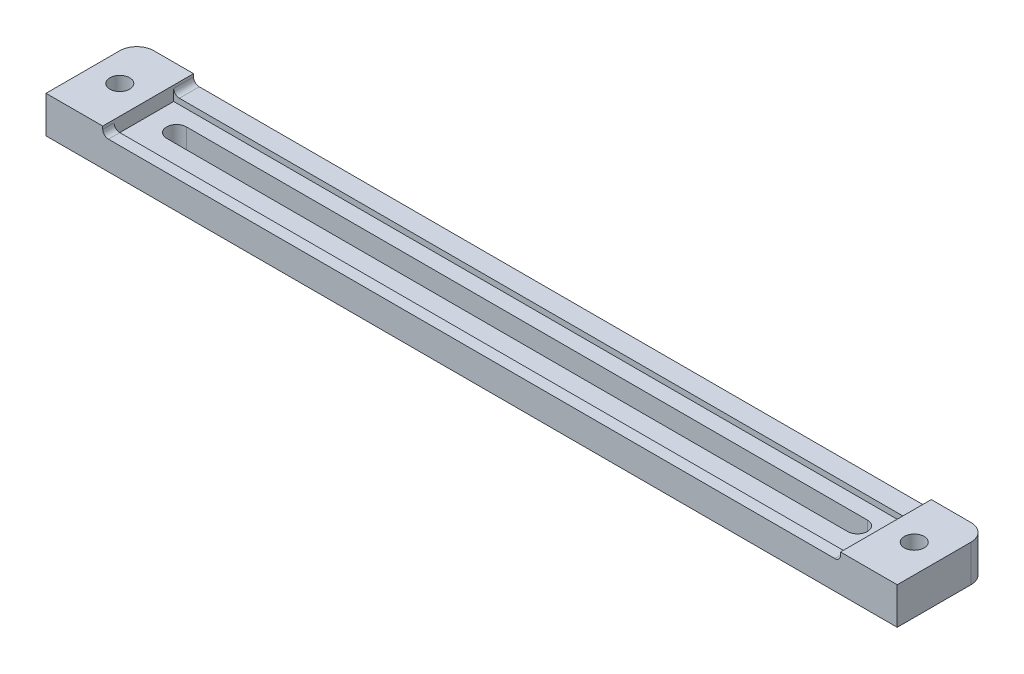
from build123d import *

# Parameters (mm, degrees)
SKETCH1_R           = 1.75
BOSS_EXTRUDE1_DEPTH = 4
SKETCH2_W           = 130
SKETCH2_H           = 10.5
SKETCH2_R           = 1.75
BOSS_EXTRUDE2_DEPTH = 1
SKETCH3_R           = 1.75
BOSS_EXTRUDE3_DEPTH = 1.5
FILLET1_R           = 1


with BuildPart() as part:
    # Sketch1 → Boss-Extrude1 (new body)
    with BuildSketch(Plane(origin=(0, 0, 0), x_dir=(1, 0, 0), z_dir=(0, 1, 0))):
        with BuildLine():
            Line((-75, -8), (75, -8))
            Line((75, -8), (75, 5))
            ThreePointArc((75, 5), (74.121320344, 7.121320344), (72, 8))
            Line((72, 8), (-72, 8))
            ThreePointArc((-72, 8), (-74.121320344, 7.121320344), (-75, 5))
            Line((-75, 5), (-75, -8))
        make_face()
        with Locations(Location((-70, 0, 0), (0, 0, 270))):
            Circle(SKETCH1_R, mode=Mode.SUBTRACT)
        with BuildLine():
            ThreePointArc((61.75, 0), (61.237436867, -1.237436867), (60, -1.75))
            Line((60, -1.75), (-60, -1.75))
            ThreePointArc((-60, -1.75), (-61.75, 0), (-60, 1.75))
            Line((-60, 1.75), (60, 1.75))
            ThreePointArc((60, 1.75), (61.237436867, 1.237436867), (61.75, 0))
        make_face(mode=Mode.SUBTRACT)
        with Locations(Location((70, 0, 0), (0, 0, 270))):
            Circle(SKETCH1_R, mode=Mode.SUBTRACT)
    extrude(amount=BOSS_EXTRUDE1_DEPTH)

    # Sketch2 → Boss-Extrude2 (add)
    with BuildSketch(Plane(origin=(0, 4, 0), x_dir=(1, 0, 0), z_dir=(0, 1, 0))):
        with BuildLine():
            Line((-75, -8), (75, -8))
            Line((75, -8), (75, 5))
            ThreePointArc((75, 5), (74.121320344, 7.121320344), (72, 8))
            Line((72, 8), (-72, 8))
            ThreePointArc((-72, 8), (-74.121320344, 7.121320344), (-75, 5))
            Line((-75, 5), (-75, -8))
        make_face()
        with Locations((0, -0.75)):
            Rectangle(SKETCH2_W, SKETCH2_H, mode=Mode.SUBTRACT)
        with Locations(Location((-70, 0, 0), (0, 0, 270))):
            Circle(SKETCH2_R, mode=Mode.SUBTRACT)
        with Locations(Location((70, 0, 0), (0, 0, 270))):
            Circle(SKETCH2_R, mode=Mode.SUBTRACT)
    extrude(amount=BOSS_EXTRUDE2_DEPTH)

    # Sketch3 → Boss-Extrude3 (add)
    # profile 1 of 2: a face of its own
    with BuildSketch(Plane(origin=(0, 5, 0), x_dir=(1, 0, 0), z_dir=(0, 1, 0))):
        with BuildLine():
            Line((65, 4.5), (65, 8))
            Line((65, 8), (72, 8))
            ThreePointArc((72, 8), (74.121320344, 7.121320344), (75, 5))
            Line((75, 5), (75, -8))
            Line((75, -8), (65, -8))
            Line((65, -8), (65, -6))
            Line((65, -6), (65, 4.5))
        make_face()
        with Locations(Location((70, 0, 0), (0, 0, 270))):
            Circle(SKETCH3_R, mode=Mode.SUBTRACT)
    # profile 2 of 2: a face of its own
    with BuildSketch(Plane(origin=(0, 5, 0), x_dir=(1, 0, 0), z_dir=(0, 1, 0))):
        with BuildLine():
            Line((-65, 4.5), (-65, 8))
            Line((-65, 8), (-72, 8))
            ThreePointArc((-72, 8), (-74.121320344, 7.121320344), (-75, 5))
            Line((-75, 5), (-75, -8))
            Line((-75, -8), (-65, -8))
            Line((-65, -8), (-65, -6))
            Line((-65, -6), (-65, 4.5))
        make_face()
        with Locations(Location((-70, 0, 0), (0, 0, 270))):
            Circle(SKETCH3_R, mode=Mode.SUBTRACT)
    extrude(amount=BOSS_EXTRUDE3_DEPTH)

    # Fillet1
    fillet1_edges = [part.edges().sort_by_distance(p)[0] for p in [
        (-65, 5, 7),
        (65, 5, 7),
        (65, 5, -6.25),
        (-65, 5, -6.25),
    ]]
    fillet(fillet1_edges, radius=FILLET1_R)


solid = part.part
